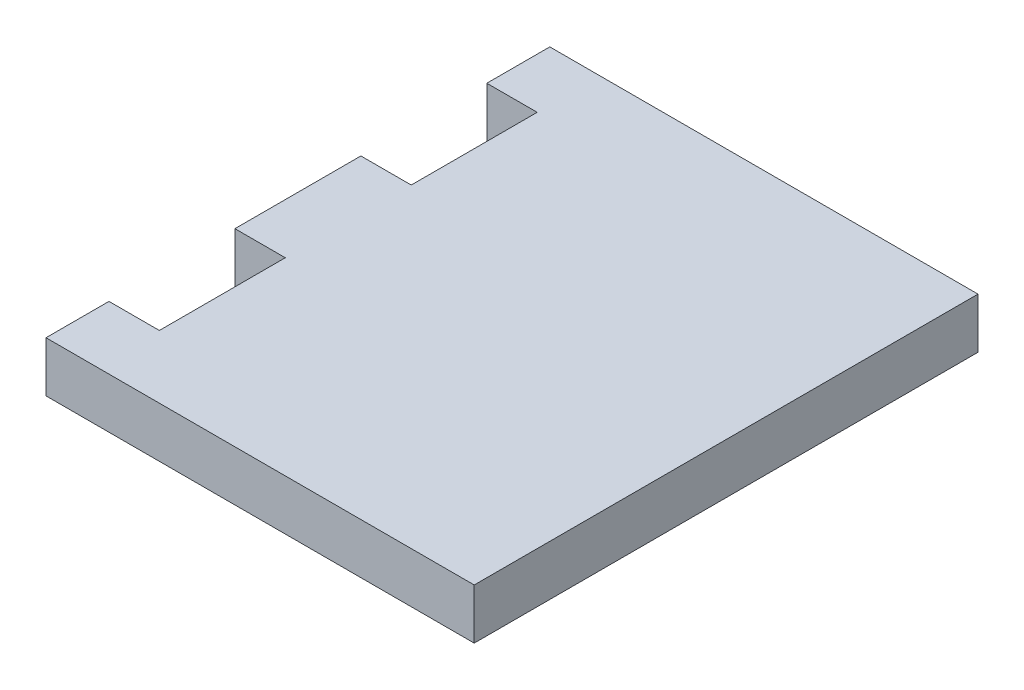
from build123d import *

# Parameters (mm, degrees)
SKETCH1_W           = 30
SKETCH1_H           = 20
SKETCH1_W_2         = 2
SKETCH1_H_2         = 5
BOSS_EXTRUDE1_DEPTH = 2
SKETCH2_R           = 1.5
CUT_EXTRUDE1_DEPTH  = 10
SKETCH3_W           = 13
SKETCH3_H           = 20
CUT_EXTRUDE2_DEPTH  = 10


with BuildPart() as part:
    # Sketch1 → Boss-Extrude1 (new body)
    with BuildSketch(Plane(origin=(0, 0, 0), x_dir=(1, 0, 0), z_dir=(0, 1, 0))):
        Rectangle(SKETCH1_W, SKETCH1_H)
        with Locations((-1, 5)):
            Rectangle(SKETCH1_W_2, SKETCH1_H_2, mode=Mode.SUBTRACT)
        with Locations((-1, -5)):
            Rectangle(SKETCH1_W_2, SKETCH1_H_2, mode=Mode.SUBTRACT)
    extrude(amount=BOSS_EXTRUDE1_DEPTH)

    # Sketch2 → Cut-Extrude1 (cut)
    with BuildSketch(Plane(origin=(0, 2, 0), x_dir=(1, 0, 0), z_dir=(0, 1, 0))):
        with Locations(Location((-10, 5, 0), (0, 0, 270))):
            Circle(SKETCH2_R)
        with Locations(Location((-10, -5, 0), (0, 0, 270))):
            Circle(SKETCH2_R)
    extrude(amount=-CUT_EXTRUDE1_DEPTH, mode=Mode.SUBTRACT)

    # Sketch3 → Cut-Extrude2 (cut)
    with BuildSketch(Plane(origin=(0, 2, 0), x_dir=(1, 0, 0), z_dir=(0, 1, 0))):
        with Locations((-8.5, 0)):
            Rectangle(SKETCH3_W, SKETCH3_H)
    extrude(amount=-CUT_EXTRUDE2_DEPTH, mode=Mode.SUBTRACT)


solid = part.part
